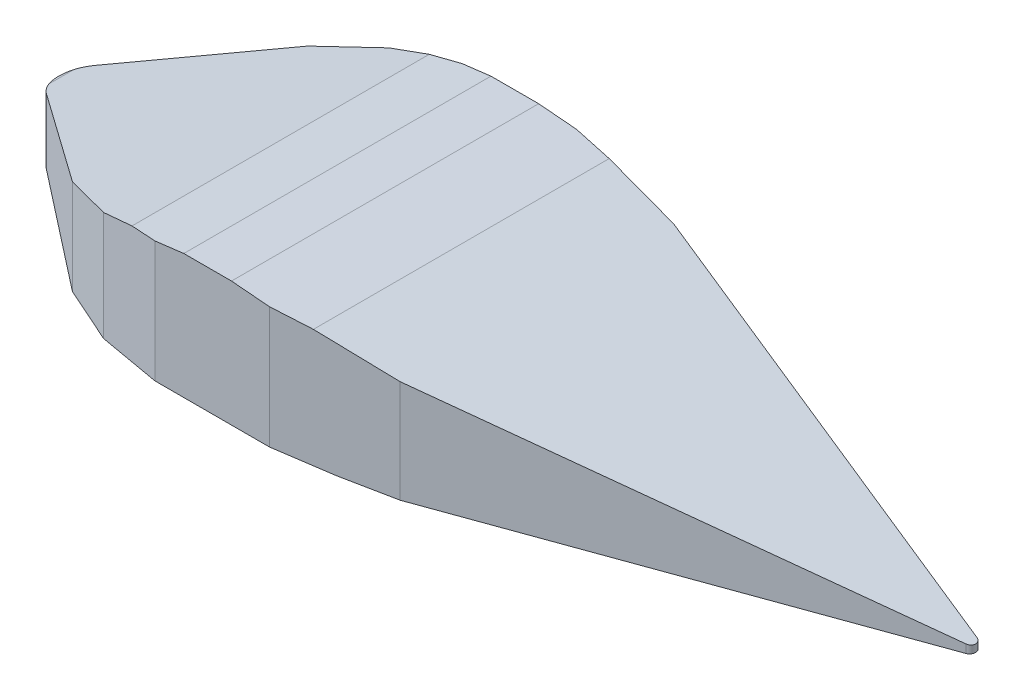
from build123d import *

# Parameters (mm, degrees)
TOPVIEW_EXTRUDE_DEPTH      = 800
SIDEPROFILE_CUT_DEPTH      = 5006.734380578
SIDEPROFILE_CUT_DEPTH_BACK = 5006.734380578
SKETCH2_OUTSIDE_W          = 5798.358
SKETCH2_OUTSIDE_H          = 1822.06


with BuildPart() as part:
    # Sketch1 → TopView_Extrude (new body)
    with BuildSketch(Plane(origin=(0, 0, 0), x_dir=(1, 0, 0), z_dir=(0, 1, 0))):
        with BuildLine():
            Line((161.409759475, 126.088702216), (784.13, 612.54))
            Line((784.13, 612.54), (1076.464, 742.696))
            Line((1076.464, 742.696), (1401.451, 800))
            Line((1401.451, 800), (1997.019, 800))
            Line((1997.019, 800), (2590.582, 712.35))
            Line((2590.582, 712.35), (4854.876103105, 28.719585912))
            ThreePointArc((4854.876103105, 28.719585912), (4876.205152462, 0), (4854.876103105, -28.719585912))
            Line((4854.876103105, -28.719585912), (2590.582, -712.35))
            Line((2590.582, -712.35), (1997.019, -800))
            Line((1997.019, -800), (1401.451, -800))
            Line((1401.451, -800), (1076.464, -742.696))
            Line((1076.464, -742.696), (784.13, -612.54))
            Line((784.13, -612.54), (161.409759475, -126.088702216))
            ThreePointArc((161.409759475, -126.088702216), (99.906658784, 0), (161.409759475, 126.088702216))
        make_face()
    extrude(amount=TOPVIEW_EXTRUDE_DEPTH)

    # Sketch2 outside → SideProfile_Cut (cut, two sides: drawn at the far end of the back side and taken through both)
    with BuildSketch(Plane.XY.offset(-SIDEPROFILE_CUT_DEPTH_BACK)):
        with Locations((2488.056, 400)):
            Rectangle(SKETCH2_OUTSIDE_W, SKETCH2_OUTSIDE_H)
        with BuildLine():
            Line((0, 300), (0, 332.854109989))
            ThreePointArc((0, 332.854109989), (31.780435884, 425.180350356), (113.655128803, 478.384348558))
            Line((113.655128803, 478.384348558), (1255.921, 763.655))
            Line((1255.921, 763.655), (1551.451, 800))
            Line((1551.451, 800), (1800, 800))
            Line((1800, 800), (2197.056, 765.81))
            Line((2197.056, 765.81), (4950, 288.165))
            Line((4950, 288.165), (4950, 265.638))
            Line((4950, 265.638), (2301.451, 150))
            Line((2301.451, 150), (150, 150))
            ThreePointArc((150, 150), (43.933982822, 193.933982822), (0, 300))
        make_face(mode=Mode.SUBTRACT)
    extrude(amount=SIDEPROFILE_CUT_DEPTH + SIDEPROFILE_CUT_DEPTH_BACK, mode=Mode.SUBTRACT)


solid = part.part
